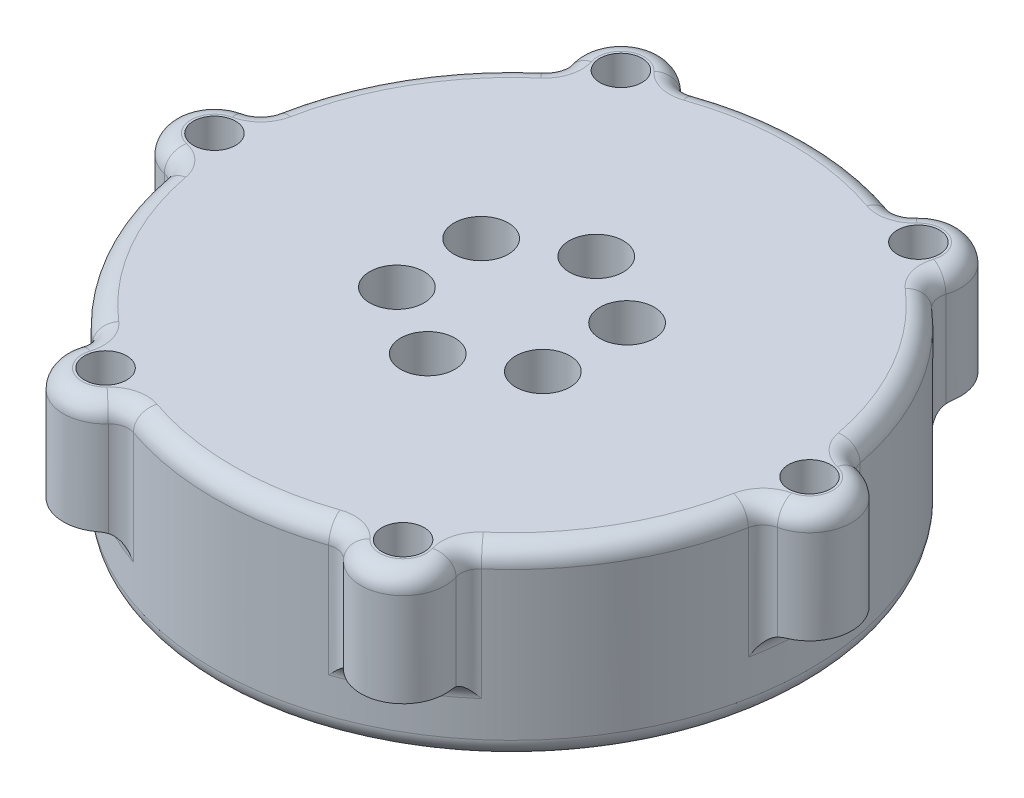
from build123d import *

# Parameters (mm, degrees)
SKETCH1_R           = 31.78
BOSS_EXTRUDE1_DEPTH = 8
BOSS_EXTRUDE2_START = -11.8
SKETCH1_3_R         = 31.78
SKETCH1_3_R_2       = 28.78
BOSS_EXTRUDE2_DEPTH = 11.8
SKETCH1_5_R         = 12.5
BOSS_EXTRUDE3_DEPTH = 11
SKETCH2_R           = 1.25
CUT_EXTRUDE1_DEPTH  = 49.79484399
CUT_EXTRUDE2_START  = -4
SKETCH2_3_R         = 2.9
SKETCH2_3_R_2       = 1.25
CUT_EXTRUDE2_DEPTH  = 45.79484399
BOSS_EXTRUDE4_START = -12
BOSS_EXTRUDE4_DEPTH = 12
SKETCH4_R           = 2.25
CUT_EXTRUDE3_DEPTH  = 10
FILLET1_R           = 2


with BuildPart() as part:
    # Sketch1 → Boss-Extrude1 (new body)
    with BuildSketch(Plane(origin=(0, 0, 0), x_dir=(1, 0, 0), z_dir=(0, 1, 0))):
        Circle(SKETCH1_R)
    extrude(amount=BOSS_EXTRUDE1_DEPTH)

    # Sketch1<3> → Boss-Extrude2 (add)
    with BuildSketch(Plane(origin=(0, 0, 0), x_dir=(1, 0, 0), z_dir=(0, 1, 0)).offset(BOSS_EXTRUDE2_START)):
        Circle(SKETCH1_3_R)
        Circle(SKETCH1_3_R_2, mode=Mode.SUBTRACT)
    extrude(amount=BOSS_EXTRUDE2_DEPTH)

    # Sketch1<5> → Boss-Extrude3 (add)
    with BuildSketch(Plane(origin=(0, 0, 0), x_dir=(1, 0, 0), z_dir=(0, 1, 0))):
        Circle(SKETCH1_5_R)
    extrude(amount=-BOSS_EXTRUDE3_DEPTH)

    # Sketch2 → Cut-Extrude1 (cut, through all)
    with BuildSketch(Plane.XZ.offset(11)):
        with Locations((0, 9)):
            Circle(SKETCH2_R)
        with Locations((7.794228634, 4.5)):
            Circle(SKETCH2_R)
        with Locations((7.794228634, -4.5)):
            Circle(SKETCH2_R)
        with Locations((0, -9)):
            Circle(SKETCH2_R)
        with Locations((-7.794228634, -4.5)):
            Circle(SKETCH2_R)
        with Locations((-7.794228634, 4.5)):
            Circle(SKETCH2_R)
    extrude(amount=-CUT_EXTRUDE1_DEPTH, mode=Mode.SUBTRACT)

    # Sketch2<3> → Cut-Extrude2 (cut, through all)
    # profile 1 of 6: a face of its own
    with BuildSketch(Plane.XZ.offset(11).offset(CUT_EXTRUDE2_START)):
        with Locations((0, 9)):
            Circle(SKETCH2_3_R)
        with Locations((0, 9)):
            Circle(SKETCH2_3_R_2, mode=Mode.SUBTRACT)
    # profile 2 of 6: a face of its own
    with BuildSketch(Plane.XZ.offset(11).offset(CUT_EXTRUDE2_START)):
        with Locations((-7.794228634, 4.5)):
            Circle(SKETCH2_3_R)
        with Locations((-7.794228634, 4.5)):
            Circle(SKETCH2_3_R_2, mode=Mode.SUBTRACT)
    # profile 3 of 6: a face of its own
    with BuildSketch(Plane.XZ.offset(11).offset(CUT_EXTRUDE2_START)):
        with Locations((-7.794228634, -4.5)):
            Circle(SKETCH2_3_R)
        with Locations((-7.794228634, -4.5)):
            Circle(SKETCH2_3_R_2, mode=Mode.SUBTRACT)
    # profile 4 of 6: a face of its own
    with BuildSketch(Plane.XZ.offset(11).offset(CUT_EXTRUDE2_START)):
        with Locations((0, -9)):
            Circle(SKETCH2_3_R)
        with Locations((0, -9)):
            Circle(SKETCH2_3_R_2, mode=Mode.SUBTRACT)
    # profile 5 of 6: a face of its own
    with BuildSketch(Plane.XZ.offset(11).offset(CUT_EXTRUDE2_START)):
        with Locations((7.794228634, -4.5)):
            Circle(SKETCH2_3_R)
        with Locations((7.794228634, -4.5)):
            Circle(SKETCH2_3_R_2, mode=Mode.SUBTRACT)
    # profile 6 of 6: a face of its own
    with BuildSketch(Plane.XZ.offset(11).offset(CUT_EXTRUDE2_START)):
        with Locations((7.794228634, 4.5)):
            Circle(SKETCH2_3_R)
        with Locations((7.794228634, 4.5)):
            Circle(SKETCH2_3_R_2, mode=Mode.SUBTRACT)
    extrude(amount=-CUT_EXTRUDE2_DEPTH, mode=Mode.SUBTRACT)

    # Sketch3 → Boss-Extrude4 (add)
    with BuildSketch(Plane(origin=(0, 8, 0), x_dir=(1, 0, 0), z_dir=(0, 1, 0)).offset(BOSS_EXTRUDE4_START)):
        with BuildLine():
            ThreePointArc((-31.461403398, -4.488707632), (-31.78, 0), (-31.461403398, 4.488707632))
            ThreePointArc((-31.461403398, 4.488707632), (-36.28, 0), (-31.461403398, -4.488707632))
        make_face()
        with BuildLine():
            ThreePointArc((-11.84336686, 29.490728398), (-18.14, 31.419401649), (-19.618036539, 25.002020766))
            ThreePointArc((-19.618036539, 25.002020766), (-15.89, 27.522287332), (-11.84336686, 29.490728398))
        make_face()
        with BuildLine():
            ThreePointArc((-11.84336686, -29.490728398), (-15.89, -27.522287332), (-19.618036539, -25.002020766))
            ThreePointArc((-19.618036539, -25.002020766), (-18.14, -31.419401649), (-11.84336686, -29.490728398))
        make_face()
        with BuildLine():
            ThreePointArc((19.618036539, 25.002020766), (18.14, 31.419401649), (11.84336686, 29.490728398))
            ThreePointArc((11.84336686, 29.490728398), (15.89, 27.522287332), (19.618036539, 25.002020766))
        make_face()
        with BuildLine():
            ThreePointArc((19.618036539, -25.002020766), (15.89, -27.522287332), (11.84336686, -29.490728398))
            ThreePointArc((11.84336686, -29.490728398), (18.14, -31.419401649), (19.618036539, -25.002020766))
        make_face()
        with BuildLine():
            ThreePointArc((31.461403398, -4.488707632), (36.28, 0), (31.461403398, 4.488707632))
            ThreePointArc((31.461403398, 4.488707632), (31.78, 0), (31.461403398, -4.488707632))
        make_face()
    extrude(amount=BOSS_EXTRUDE4_DEPTH)

    # Sketch4 → Cut-Extrude3 (cut)
    with BuildSketch(Plane(origin=(0, 8, 0), x_dir=(1, 0, 0), z_dir=(0, 1, 0))):
        with Locations((-15.89, 27.522287332)):
            Circle(SKETCH4_R)
        with Locations((15.89, 27.522287332)):
            Circle(SKETCH4_R)
        with Locations((31.78, 0)):
            Circle(SKETCH4_R)
        with Locations((15.89, -27.522287332)):
            Circle(SKETCH4_R)
        with Locations((-15.89, -27.522287332)):
            Circle(SKETCH4_R)
        with Locations((-31.78, 0)):
            Circle(SKETCH4_R)
    extrude(amount=-CUT_EXTRUDE3_DEPTH, mode=Mode.SUBTRACT)

    # Fillet1
    fillet1_edges = [part.edges().sort_by_distance(p)[0] for p in [
        (18.14, 8, 31.419401649),
        (36.28, 8, 0),
        (18.14, 8, -31.419401649),
        (-18.14, 8, -31.419401649),
        (-36.28, 8, 0),
        (-18.14, 8, 31.419401649),
        (-31.78, -11.8, 0),
        (-11.84336686, 2, 29.490728398),
        (0, 8, 31.78),
        (11.84336686, 2, 29.490728398),
        (15.89, -4, 27.522287332),
        (19.618036539, 2, 25.002020766),
        (27.522287332, 8, 15.89),
        (31.461403398, 2, 4.488707632),
        (31.700250788, -4, -2.25),
        (31.461403398, 2, -4.488707632),
        (27.522287332, 8, -15.89),
        (19.618036539, 2, -25.002020766),
        (15.89, -4, -27.522287332),
        (11.84336686, 2, -29.490728398),
        (0, 8, -31.78),
        (-11.84336686, 2, -29.490728398),
        (-15.89, -4, -27.522287332),
        (-19.618036539, 2, -25.002020766),
        (-27.522287332, 8, -15.89),
        (-31.461403398, 2, -4.488707632),
        (-31.78, -4, 0),
        (-31.461403398, 2, 4.488707632),
        (-27.522287332, 8, 15.89),
        (-19.618036539, 2, 25.002020766),
        (-15.89, -4, 27.522287332),
    ]]
    fillet(fillet1_edges, radius=FILLET1_R)


solid = part.part
